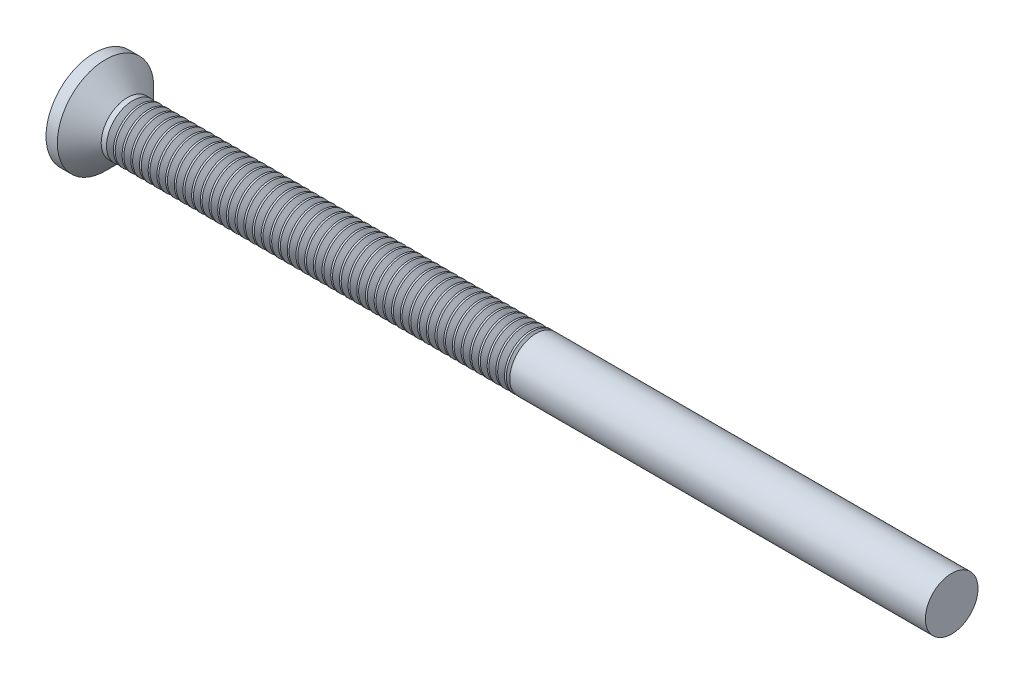
from build123d import *

# Parameters (mm, degrees)
CIRPATTERN1_COUNT       = 2
CIRPATTERN1_ANGLE       = 90
THDSCHPAT_COUNT         = 47
THDSCHPAT_PITCH         = 0.495652174
CROQUIS2_R              = 1.5
SALIENTE_EXTRUIR1_DEPTH = 23.7


with BuildPart() as part:
    # BodySke → Base-Revolve (revolve)
    with BuildSketch(Plane.XY, mode=Mode.PRIVATE) as base_revolve_sk:
        with BuildLine():
            Line((0, 0), (25.727669073, 0))
            Line((25.727669073, 0), (25.727669073, 1.5))
            Line((25.727669073, 1.5), (2.427669073, 1.5))
            Line((2.427669073, 1.5), (1.177669073, 2.75))
            Line((1.177669073, 2.75), (0.529956332, 2.75))
            ThreePointArc((0.529956332, 2.75), (0.133696843, 1.400299407), (0, 0))
        make_face()
    revolve(base_revolve_sk.sketch.rotate(Axis((-15.875, 0, 0), (1, 0, 0)), 90), axis=Axis((-15.875, 0, 0), (1, 0, 0)))

    # Sketch3 → Cross section 0
    with BuildSketch(Plane(origin=(0, 0, 0), x_dir=(0, 0, -1), z_dir=(1, 0, 0))):
        with BuildLine():
            Line((0.415, -1.72), (-0.415, -1.72))
            Line((-0.415, -1.72), (-0.415, 1.72))
            Line((-0.415, 1.72), (0.415, 1.72))
            Line((0.415, 1.72), (0.415, -1.72))
        make_face()
    # Sketch4 → Cross section 1
    with BuildSketch(Plane(origin=(2.33, 0, 0), x_dir=(0, 0, -1), z_dir=(1, 0, 0))):
        with BuildLine():
            Line((0.2075, -0.2075), (-0.2075, -0.2075))
            Line((-0.2075, -0.2075), (-0.2075, 0.2075))
            Line((-0.2075, 0.2075), (0.2075, 0.2075))
            Line((0.2075, 0.2075), (0.2075, -0.2075))
        make_face()
    cross = loft(mode=Mode.SUBTRACT)

    # CirPattern1: Cross ×2 about axis
    cirpattern1_axis = Axis((0, 0, 0), (1, 0, 0))
    for i in range(1, CIRPATTERN1_COUNT):
        add(cross.rotate(cirpattern1_axis, i * CIRPATTERN1_ANGLE / (CIRPATTERN1_COUNT - 1)), mode=Mode.SUBTRACT)

    # ThdSchSke → ThreadSchematic (revolve, cut)
    with BuildSketch(Plane.XY):
        Polygon((2.927669073, -1.2195), (2.731260858, -1.5), (2.731260858, -1.875), (3.124077287, -1.875), (3.124077287, -1.5), align=None)
    threadschematic = revolve(axis=Axis((-3.175, 0, 0), (1, 0, 0)), mode=Mode.SUBTRACT)

    # ThdSchPat: ThreadSchematic ×47
    with Locations(*[(i * THDSCHPAT_PITCH, 0, 0) for i in range(1, THDSCHPAT_COUNT)]):
        add(threadschematic, mode=Mode.SUBTRACT)

    # Croquis2 → Saliente-Extruir1 (add)
    with BuildSketch(Plane(origin=(25.727669073, 0, 0), x_dir=(0, 0, -1), z_dir=(1, 0, 0))):
        with Locations(Location((0, 0, 0), (0, 0, 180))):
            Circle(CROQUIS2_R)
    extrude(amount=SALIENTE_EXTRUIR1_DEPTH)


solid = part.part
